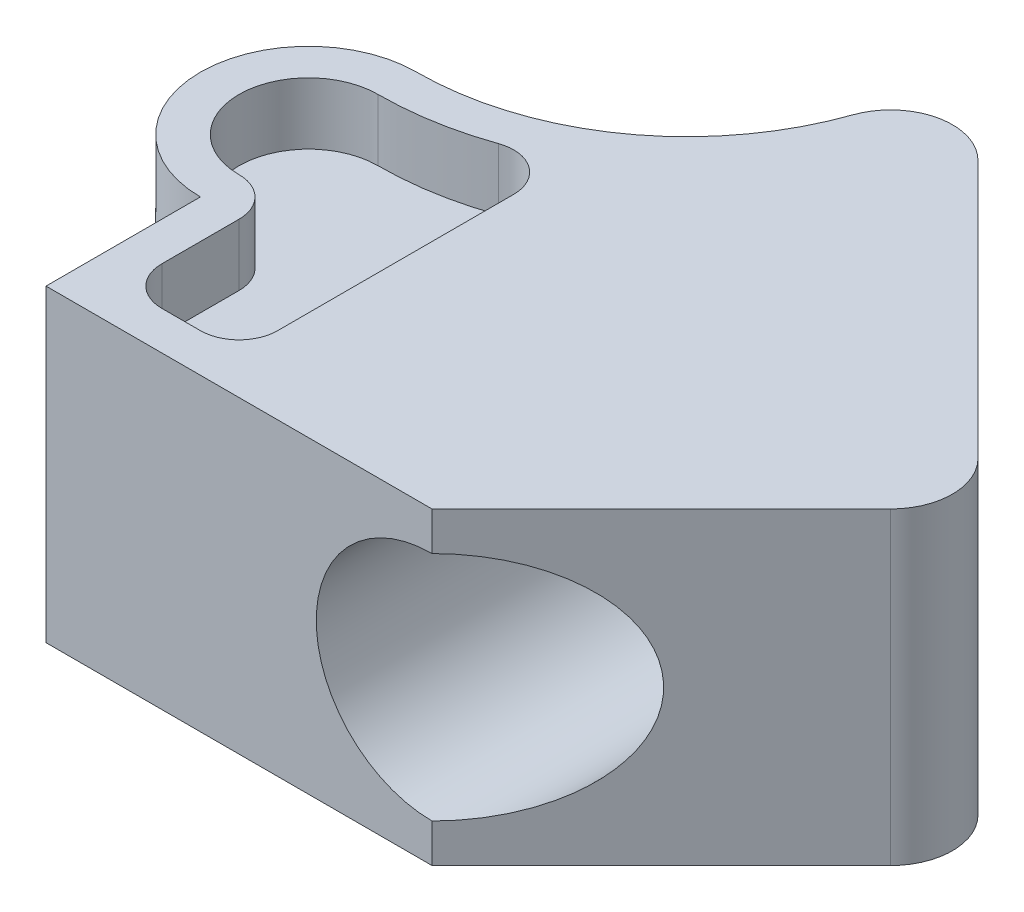
from build123d import *

# Parameters (mm, degrees)
BOSS_EXTRUDE1_DEPTH     = 40
CUT_EXTRUDE1_DEPTH      = 8
CUT_EXTRUDE2_DEPTH      = 120.290091807
CUT_EXTRUDE2_DEPTH_BACK = 120.290091807
SKETCH3_R               = 15


with BuildPart() as part:
    # Sketch1 → Boss-Extrude1 (new body)
    with BuildSketch(Plane(origin=(0, 0, 0), x_dir=(1, 0, 0), z_dir=(0, 1, 0))):
        with BuildLine():
            Line((0, 0), (50, 0))
            Line((50, 0), (79.69848481, 29.69848481))
            ThreePointArc((79.69848481, 29.69848481), (82.04163056, 35.355339059), (79.69848481, 41.012193309))
            Line((79.69848481, 41.012193309), (46.246943589, 74.463734529))
            ThreePointArc((46.246943589, 74.463734529), (38.809068701, 76.606108799), (33.038444811, 71.447460693))
            ThreePointArc((33.038444811, 71.447460693), (20.256617737, 54.457585283), (0, 48))
            ThreePointArc((0, 48), (-14, 34), (0, 20))
            Line((0, 20), (0, 0))
        make_face()
    extrude(amount=BOSS_EXTRUDE1_DEPTH)

    # Sketch2 → Cut-Extrude1 (cut)
    with BuildSketch(Plane(origin=(0, 40, 0), x_dir=(1, 0, 0), z_dir=(0, 1, 0))):
        with BuildLine():
            Line((20, 10), (20, 40.573593129))
            ThreePointArc((20, 40.573593129), (17.886751346, 44.656076033), (13.333333333, 45.287638337))
            ThreePointArc((13.333333333, 45.287638337), (6.764079149, 43.576057614), (0, 43))
            ThreePointArc((0, 43), (-9, 34), (0, 25))
            ThreePointArc((0, 25), (3.535533906, 23.535533906), (5, 20))
            Line((5, 20), (5, 10))
            ThreePointArc((5, 10), (6.464466094, 6.464466094), (10, 5))
            Line((10, 5), (15, 5))
            ThreePointArc((15, 5), (18.535533906, 6.464466094), (20, 10))
        make_face()
    extrude(amount=-CUT_EXTRUDE1_DEPTH, mode=Mode.SUBTRACT)

    # Sketch3 → Cut-Extrude2 (cut, two sides: drawn at the far end of the back side and taken through both)
    with BuildSketch(Plane.XY.offset(-CUT_EXTRUDE2_DEPTH_BACK)):
        with Locations(Location((50, 20, 0), (0, 0, 90))):
            Circle(SKETCH3_R)
        with BuildLine():
            Line((-14, 28), (-14, 12))
            ThreePointArc((-14, 12), (-6, 20), (-14, 28))
        make_face()
    extrude(amount=CUT_EXTRUDE2_DEPTH + CUT_EXTRUDE2_DEPTH_BACK, mode=Mode.SUBTRACT)


solid = part.part
